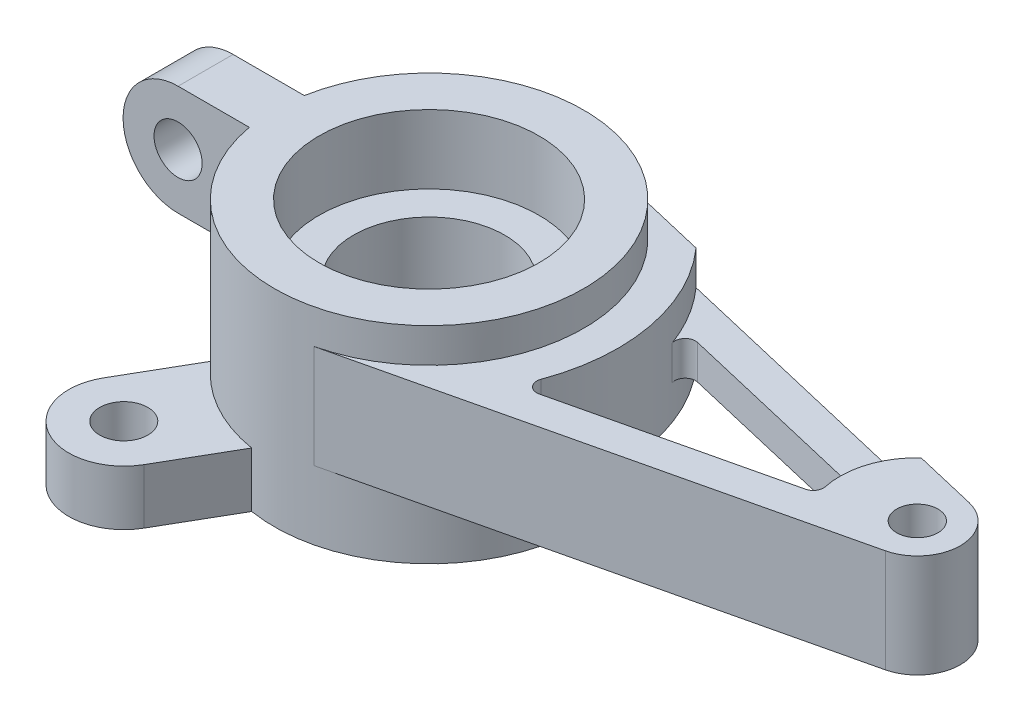
from build123d import *

# Parameters (mm, degrees)
SKETCH1_R           = 4.5
BOSS_EXTRUDE1_DEPTH = 6
SKETCH2_R           = 0.7
BOSS_EXTRUDE2_DEPTH = 1.6
SKETCH3_R           = 0.7
BOSS_EXTRUDE3_DEPTH = 0.8
BOSS_EXTRUDE4_START = -4
SKETCH4_R           = 0.6
BOSS_EXTRUDE4_DEPTH = 3
CUT_EXTRUDE1_START  = -2
CUT_EXTRUDE1_DEPTH  = 1
CUT_EXTRUDE2_START  = -4
CUT_EXTRUDE2_DEPTH  = 1
FILLET1_R           = 0.3
SKETCH5_R           = 2.2
CUT_EXTRUDE4_DEPTH  = 19.08212732
SKETCH9_R           = 3.2
SKETCH9_R_2         = 2.2
CUT_EXTRUDE5_DEPTH  = 2


with BuildPart() as part:
    # Sketch1 → Boss-Extrude1 (new body)
    with BuildSketch(Plane(origin=(0, 0, 0), x_dir=(1, 0, 0), z_dir=(0, 1, 0))):
        Circle(SKETCH1_R)
    extrude(amount=BOSS_EXTRUDE1_DEPTH)

    # Sketch2 → Boss-Extrude2 (add)
    # profile 1 of 2: a face of its own
    with BuildSketch(Plane.XZ):
        with BuildLine():
            Line((-0.717333438, 4.442457961), (-1.864359354, 6.429165125))
            ThreePointArc((-1.864359354, 6.429165125), (-4.05, 7.014805771), (-4.635640646, 4.829165125))
            Line((-4.635640646, 4.829165125), (-3.488614731, 2.842457961))
            ThreePointArc((-3.488614731, 2.842457961), (-2.25, 3.897114317), (-0.717333438, 4.442457961))
        make_face()
        with Locations((-3.25, 5.629165125)):
            Circle(SKETCH2_R, mode=Mode.SUBTRACT)
    # profile 2 of 2: a face of its own
    with BuildSketch(Plane.XZ):
        with BuildLine():
            ThreePointArc((-0.717333438, -4.442457961), (-2.25, -3.897114317), (-3.488614731, -2.842457961))
            Line((-3.488614731, -2.842457961), (-4.635640646, -4.829165125))
            ThreePointArc((-4.635640646, -4.829165125), (-4.05, -7.014805771), (-1.864359354, -6.429165125))
            Line((-1.864359354, -6.429165125), (-0.717333438, -4.442457961))
        make_face()
        with Locations((-3.25, -5.629165125)):
            Circle(SKETCH2_R, mode=Mode.SUBTRACT)
    extrude(amount=-BOSS_EXTRUDE2_DEPTH)

    # Sketch3 → Boss-Extrude3 (add, symmetric)
    with BuildSketch(Plane.XY):
        with BuildLine():
            Line((-3.5, 6), (-6.5, 6))
            ThreePointArc((-6.5, 6), (-8.1, 4.4), (-6.5, 2.8))
            Line((-6.5, 2.8), (-3.5, 2.8))
            Line((-3.5, 2.8), (-3.5, 6))
        make_face()
        with Locations((-6.5, 4.4)):
            Circle(SKETCH3_R, mode=Mode.SUBTRACT)
    extrude(amount=BOSS_EXTRUDE3_DEPTH, both=True)

    # Sketch4 → Boss-Extrude4 (add)
    with BuildSketch(Plane(origin=(0, 6, 0), x_dir=(1, 0, 0), z_dir=(0, 1, 0)).offset(BOSS_EXTRUDE4_START)):
        with BuildLine():
            ThreePointArc((1.029929577, 4.380553055), (4.5, 0), (1.029929577, -4.380553055))
            Line((1.029929577, -4.380553055), (14.486091549, -1.216820293))
            ThreePointArc((14.486091549, -1.216820293), (15.45, 0), (14.486091549, 1.216820293))
            Line((14.486091549, 1.216820293), (1.029929577, 4.380553055))
        make_face()
        with BuildLine():
            Line((4.931081365, 2.436069903), (12.080503997, 0.75514018))
            ThreePointArc((12.080503997, 0.75514018), (11.982866038, 0.38316706), (11.95, 0))
            ThreePointArc((11.95, 0), (11.982866038, -0.38316706), (12.080503997, -0.75514018))
            Line((12.080503997, -0.75514018), (4.931081365, -2.436069903))
            ThreePointArc((4.931081365, -2.436069903), (5.5, 0), (4.931081365, 2.436069903))
        make_face(mode=Mode.SUBTRACT)
        with Locations((14.2, 0)):
            Circle(SKETCH4_R, mode=Mode.SUBTRACT)
    extrude(amount=BOSS_EXTRUDE4_DEPTH)

    # Sketch4<3> → Cut-Extrude1 (cut)
    with BuildSketch(Plane(origin=(0, 6, 0), x_dir=(1, 0, 0), z_dir=(0, 1, 0)).offset(CUT_EXTRUDE1_START)):
        with BuildLine():
            Line((12.664921694, 1.645002916), (4.108268481, 3.656792323))
            ThreePointArc((4.108268481, 3.656792323), (4.560701943, 3.074084869), (4.931081365, 2.436069903))
            Line((4.931081365, 2.436069903), (12.080503997, 0.75514018))
            ThreePointArc((12.080503997, 0.75514018), (12.319323987, 1.235134702), (12.664921694, 1.645002916))
        make_face()
    extrude(amount=CUT_EXTRUDE1_DEPTH, mode=Mode.SUBTRACT)

    # Sketch4<4> → Cut-Extrude2 (cut)
    with BuildSketch(Plane(origin=(0, 6, 0), x_dir=(1, 0, 0), z_dir=(0, 1, 0)).offset(CUT_EXTRUDE2_START)):
        with BuildLine():
            Line((12.664921694, 1.645002916), (4.108268481, 3.656792323))
            ThreePointArc((4.108268481, 3.656792323), (4.560701943, 3.074084869), (4.931081365, 2.436069903))
            Line((4.931081365, 2.436069903), (12.080503997, 0.75514018))
            ThreePointArc((12.080503997, 0.75514018), (12.319323987, 1.235134702), (12.664921694, 1.645002916))
        make_face()
    extrude(amount=CUT_EXTRUDE2_DEPTH, mode=Mode.SUBTRACT)

    # Fillet1
    fillet1_edges = [part.edges().sort_by_distance(p)[0] for p in [
        (12.080503997, 3.5, -0.75514018),
        (12.080503997, 3.5, 0.75514018),
        (4.931081365, 3.5, -2.436069903),
        (4.931081365, 3.5, 2.436069903),
    ]]
    fillet(fillet1_edges, radius=FILLET1_R)

    # Sketch5 → Cut-Extrude4 (cut, through all)
    with BuildSketch(Plane(origin=(0, 6, 0), x_dir=(1, 0, 0), z_dir=(0, 1, 0))):
        Circle(SKETCH5_R)
    extrude(amount=-CUT_EXTRUDE4_DEPTH, mode=Mode.SUBTRACT)

    # Sketch9 → Cut-Extrude5 (cut)
    with BuildSketch(Plane(origin=(0, 6, 0), x_dir=(1, 0, 0), z_dir=(0, 1, 0))):
        Circle(SKETCH9_R)
        Circle(SKETCH9_R_2, mode=Mode.SUBTRACT)
    extrude(amount=-CUT_EXTRUDE5_DEPTH, mode=Mode.SUBTRACT)


solid = part.part
